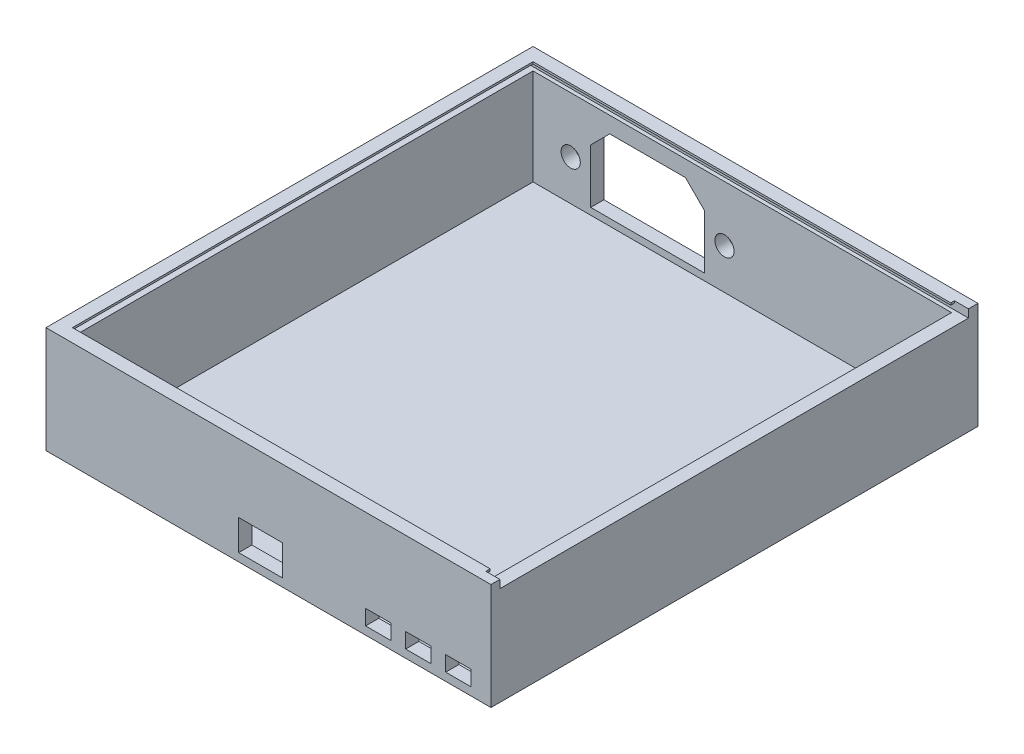
from build123d import *

# Parameters (mm, degrees)
SKETCH1_W           = 111.1
SKETCH1_H           = 121.6
BOSS_EXTRUDE1_DEPTH = 26.6
SKETCH2_W           = 104.5
SKETCH2_H           = 115
CUT_EXTRUDE1_DEPTH  = 26
SKETCH5_R           = 2.4
CUT_EXTRUDE3_DEPTH  = 4
SKETCH7_W           = 6.3
SKETCH7_H           = 3.8
SKETCH7_W_2         = 11
SKETCH7_H_2         = 7.6
CUT_EXTRUDE4_DEPTH  = 4
SKETCH8_W           = 117
SKETCH8_H           = 1.5
CUT_EXTRUDE5_DEPTH  = 110
SKETCH9_W           = 117
SKETCH9_H           = 0.5
CUT_EXTRUDE6_DEPTH  = 3.5


with BuildPart() as part:
    # Sketch1 → Boss-Extrude1 (new body)
    with BuildSketch(Plane(origin=(0, 0, 0), x_dir=(1, 0, 0), z_dir=(0, 1, 0))):
        Rectangle(SKETCH1_W, SKETCH1_H)
    extrude(amount=BOSS_EXTRUDE1_DEPTH)

    # Sketch2 → Cut-Extrude1 (cut)
    with BuildSketch(Plane(origin=(0, 26.6, 0), x_dir=(1, 0, 0), z_dir=(0, 1, 0))):
        Rectangle(SKETCH2_W, SKETCH2_H)
    extrude(amount=-CUT_EXTRUDE1_DEPTH, mode=Mode.SUBTRACT)

    # Sketch5 → Cut-Extrude3 (cut)
    with BuildSketch(Plane(origin=(0, 0, -60.8), x_dir=(-1, 0, 0), z_dir=(0, 0, -1))):
        with Locations((42.85, 10.7)):
            Circle(SKETCH5_R)
        with Locations((4.45, 10.7)):
            Circle(SKETCH5_R)
        Polygon((9.45, 2.3), (37.85, 2.3), (37.85, 15.816960095), (33.1, 20.566960095), (14.2, 20.566960095), (9.45, 15.816960095), align=None)
    extrude(amount=-CUT_EXTRUDE3_DEPTH, mode=Mode.SUBTRACT)

    # Sketch7 → Cut-Extrude4 (cut)
    with BuildSketch(Plane.XY.offset(60.8)):
        with Locations((47.4, 3.9)):
            Rectangle(SKETCH7_W, SKETCH7_H)
        with Locations((37.4, 3.9)):
            Rectangle(SKETCH7_W, SKETCH7_H)
        with Locations((27.4, 3.9)):
            Rectangle(SKETCH7_W, SKETCH7_H)
        with Locations((-1.95, 5.8)):
            Rectangle(SKETCH7_W_2, SKETCH7_H_2)
    extrude(amount=-CUT_EXTRUDE4_DEPTH, mode=Mode.SUBTRACT)

    # Sketch8 → Cut-Extrude5 (cut)
    with BuildSketch(Plane(origin=(55.55, 0, 0), x_dir=(0, 0, -1), z_dir=(1, 0, 0))):
        with Locations((-0.072921922, 25.35)):
            Rectangle(SKETCH8_W, SKETCH8_H)
    extrude(amount=-CUT_EXTRUDE5_DEPTH, mode=Mode.SUBTRACT)

    # Sketch9 → Cut-Extrude6 (cut)
    with BuildSketch(Plane(origin=(55.55, 0, 0), x_dir=(0, 0, -1), z_dir=(1, 0, 0))):
        with Locations((-0.072921922, 26.35)):
            Rectangle(SKETCH9_W, SKETCH9_H)
    extrude(amount=-CUT_EXTRUDE6_DEPTH, mode=Mode.SUBTRACT)


solid = part.part
